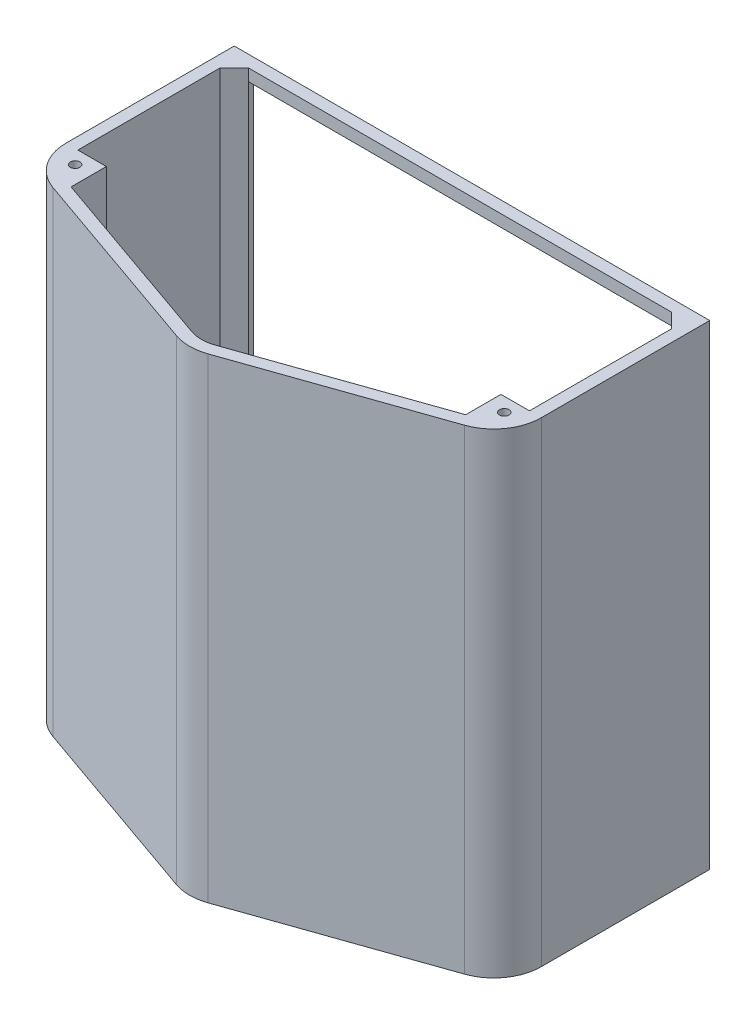
from build123d import *

# Parameters (mm, degrees)
BOSS_EXTRUDE1_DEPTH = 200
SHELL3_T            = -5
CUT_EXTRUDE1_DEPTH  = 195
BOSS_EXTRUDE2_DEPTH = 200
BOSS_EXTRUDE3_DEPTH = 200
SKETCH5_R           = 1.998576913
CUT_EXTRUDE2_DEPTH  = 210


with BuildPart() as part:
    # Sketch1 → Boss-Extrude1 (new body)
    with BuildSketch(Plane(origin=(0, 0, 0), x_dir=(1, 0, 0), z_dir=(0, 1, 0))):
        with BuildLine():
            Line((0, 0), (200, 0))
            Line((200, 0), (200, -70.8103799))
            ThreePointArc((200, -70.8103799), (196.311654881, -82.383189198), (186.607008495, -89.687547027))
            Line((186.607008495, -89.687547027), (106.607008495, -117.687547027))
            ThreePointArc((106.607008495, -117.687547027), (100, -118.8103799), (93.392991505, -117.687547027))
            Line((93.392991505, -117.687547027), (13.392991505, -89.687547027))
            ThreePointArc((13.392991505, -89.687547027), (3.688345119, -82.383189198), (0, -70.8103799))
            Line((0, -70.8103799), (0, 0))
        make_face()
    extrude(amount=BOSS_EXTRUDE1_DEPTH)

    # Shell3
    shell3_openings = [part.faces().sort_by_distance(p)[0] for p in [
        (100, 200, 51.617363214),
        (100, 0, 51.617363214),
    ]]
    offset(amount=SHELL3_T, openings=shell3_openings, kind=Kind.INTERSECTION)

    # Sketch2 → Cut-Extrude1 (cut)
    with BuildSketch(Plane(origin=(0, 0, 0), x_dir=(1, 0, 0), z_dir=(0, 1, 0))):
        Polygon((195, 0), (187.458653408, 0), (12.307944586, 0), (5, 0), (5, -3), (11, -3), (11, -5), (189, -5), (189, -3), (195, -3), align=None)
    extrude(amount=CUT_EXTRUDE1_DEPTH, mode=Mode.SUBTRACT)

    # Sketch3 → Boss-Extrude2 (add)
    with BuildSketch(Plane(origin=(0, 0, 0), x_dir=(1, 0, 0), z_dir=(0, 1, 0))):
        Polygon((5, -5), (5, -11), (11, -5), align=None)
        Polygon((195, -5), (195, -11), (189, -5), align=None)
    extrude(amount=BOSS_EXTRUDE2_DEPTH)

    # Sketch4 → Boss-Extrude3 (add)
    with BuildSketch(Plane(origin=(0, 0, 0), x_dir=(1, 0, 0), z_dir=(0, 1, 0))):
        Polygon((5, -70.8103799), (17, -70.8103799), (17, -85.652594975), (13.392991505, -89.687547027), (0, -70.8103799), align=None)
        Polygon((195, -70.8103799), (183, -70.8103799), (183, -85.652594975), (186.607008495, -89.687547027), (200, -70.8103799), align=None)
    extrude(amount=BOSS_EXTRUDE3_DEPTH)

    # Sketch5 → Cut-Extrude2 (cut)
    with BuildSketch(Plane(origin=(0, 0, 0), x_dir=(1, 0, 0), z_dir=(0, 1, 0))):
        with Locations(Location((9.743456049, -76.677329473, 0), (0, 0, 90))):
            Circle(SKETCH5_R)
        with Locations(Location((190.256543951, -76.677329473, 0), (0, 0, 90))):
            Circle(SKETCH5_R)
    extrude(amount=CUT_EXTRUDE2_DEPTH, mode=Mode.SUBTRACT)


solid = part.part
